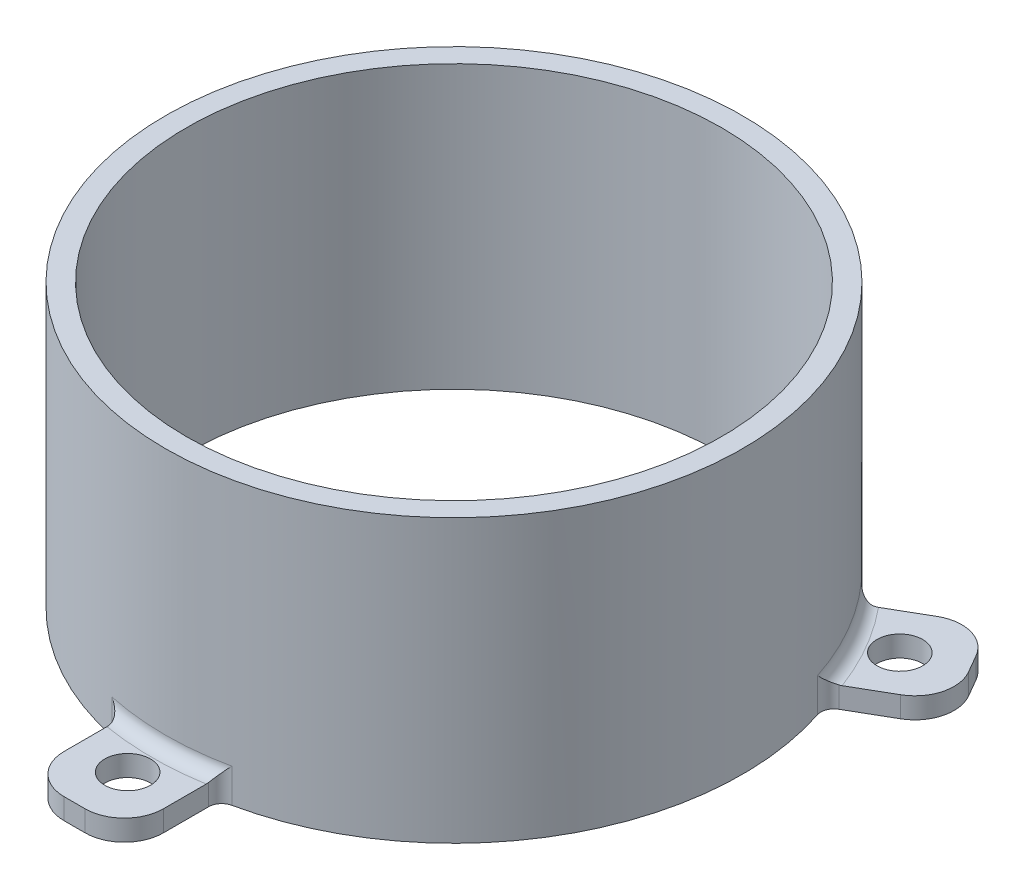
from build123d import *

# Parameters (mm, degrees)
SKETCH1_R           = 20.5
BOSS_EXTRUDE2_DEPTH = 20
SHELL1_T            = 1.6
CUT_EXTRUDE1_START  = -10
SKETCH7_R           = 20.5
CUT_EXTRUDE1_DEPTH  = 10
SKETCH8_R           = 1.75
BOSS_EXTRUDE3_DEPTH = 1.6
FILLET1_R           = 1


with BuildPart() as part:
    # Sketch1 → Boss-Extrude2 (new body)
    with BuildSketch(Plane(origin=(0, 0, 0), x_dir=(1, 0, 0), z_dir=(0, 1, 0))):
        with Locations(Location((0, 0, 0), (0, 0, 270))):
            Circle(SKETCH1_R)
    extrude(amount=BOSS_EXTRUDE2_DEPTH)

    # Shell1
    shell1_openings = [part.faces().sort_by_distance(p)[0] for p in [
        (0, 20, 0),
    ]]
    offset(amount=SHELL1_T, openings=shell1_openings, kind=Kind.INTERSECTION)

    # Sketch7 → Cut-Extrude1 (cut)
    with BuildSketch(Plane(origin=(0, 0, 0), x_dir=(1, 0, 0), z_dir=(0, 1, 0)).offset(CUT_EXTRUDE1_START)):
        with Locations(Location((0, 0, 0), (0, 0, 270))):
            Circle(SKETCH7_R)
    extrude(amount=CUT_EXTRUDE1_DEPTH, mode=Mode.SUBTRACT)

    # Sketch8 → Boss-Extrude3 (add)
    # profile 1 of 3: a face of its own
    with BuildSketch(Plane(origin=(0, 0, 0), x_dir=(1, 0, 0), z_dir=(0, 1, 0))):
        with BuildLine():
            Line((-3.803893319, -20.862908404), (-3.803893319, -26.062908404))
            ThreePointArc((-3.803893319, -26.062908404), (-2.925213663, -28.184228747), (-0.803893319, -29.062908404))
            Line((-0.803893319, -29.062908404), (0.803893319, -29.062908404))
            ThreePointArc((0.803893319, -29.062908404), (2.925213663, -28.184228747), (3.803893319, -26.062908404))
            Line((3.803893319, -26.062908404), (3.803893319, -20.862908404))
            ThreePointArc((3.803893319, -20.862908404), (0, -21.291513217), (-3.803893319, -20.862908404))
        make_face()
        with Locations(Location((0, -25, 0), (0, 0, 270))):
            Circle(SKETCH8_R, mode=Mode.SUBTRACT)
    # profile 2 of 3: a face of its own
    with BuildSketch(Plane(origin=(0, 0, 0), x_dir=(1, 0, 0), z_dir=(0, 1, 0))):
        with BuildLine():
            Line((-16.165862015, 13.725722449), (-20.669194115, 16.325722449))
            ThreePointArc((-20.669194115, 16.325722449), (-22.94565125, 16.625423717), (-24.767270326, 15.227646238))
            Line((-24.767270326, 15.227646238), (-25.571163645, 13.835262166))
            ThreePointArc((-25.571163645, 13.835262166), (-25.870864913, 11.55880503), (-24.473087434, 9.737185954))
            Line((-24.473087434, 9.737185954), (-19.969755334, 7.137185954))
            ThreePointArc((-19.969755334, 7.137185954), (-18.438991331, 10.645756608), (-16.165862015, 13.725722449))
        make_face()
        with Locations(Location((-21.650635095, 12.5, 0), (0, 0, 270))):
            Circle(SKETCH8_R, mode=Mode.SUBTRACT)
    # profile 3 of 3: a face of its own
    with BuildSketch(Plane(origin=(0, 0, 0), x_dir=(1, 0, 0), z_dir=(0, 1, 0))):
        with BuildLine():
            Line((19.969755334, 7.137185954), (24.473087434, 9.737185954))
            ThreePointArc((24.473087434, 9.737185954), (25.870864913, 11.55880503), (25.571163645, 13.835262166))
            Line((25.571163645, 13.835262166), (24.767270326, 15.227646238))
            ThreePointArc((24.767270326, 15.227646238), (22.94565125, 16.625423717), (20.669194115, 16.325722449))
            Line((20.669194115, 16.325722449), (16.165862015, 13.725722449))
            ThreePointArc((16.165862015, 13.725722449), (18.438991331, 10.645756608), (19.969755334, 7.137185954))
        make_face()
        with Locations(Location((21.650635095, 12.5, 0), (0, 0, 270))):
            Circle(SKETCH8_R, mode=Mode.SUBTRACT)
    extrude(amount=-BOSS_EXTRUDE3_DEPTH)

    # Fillet1
    fillet1_edges = [part.edges().sort_by_distance(p)[0] for p in [
        (1.909082947, 0, 22.017388635),
        (-3.803893319, -0.8, 21.770172154),
        (3.803893319, -0.8, 21.770172154),
        (-19.139161424, 0, -11.05),
        (-16.951575471, -0.8, -14.179354325),
        (-20.75546879, -0.8, -7.590817829),
        (19.139161424, 0, -11.05),
        (20.75546879, -0.8, -7.590817829),
        (16.951575471, -0.8, -14.179354325),
    ]]
    fillet(fillet1_edges, radius=FILLET1_R)


solid = part.part
